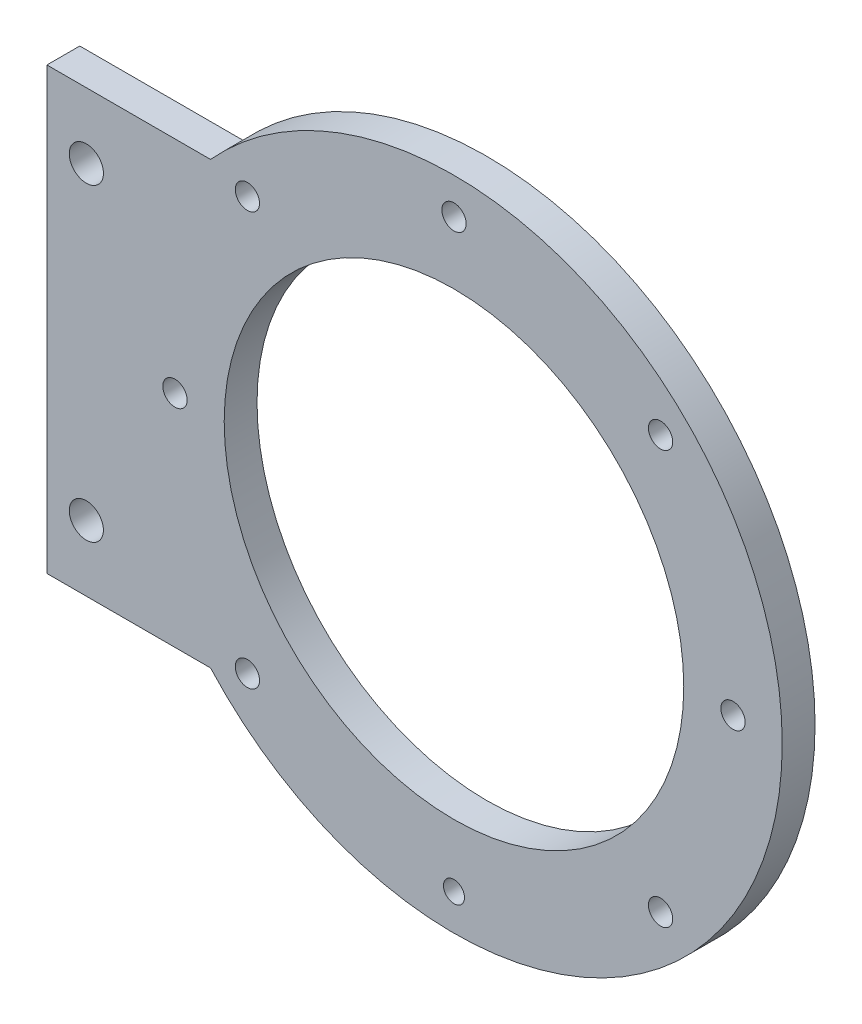
from build123d import *

# Parameters (mm, degrees)
SKETCH_1_R          = 2.6
EXTRUDE_1_DEPTH     = 5
SKETCH_2_R          = 1.85
CUT_EXTRUDE_1_DEPTH = 131.399777478
SKETCH_3_R          = 35
CUT_EXTRUDE_2_DEPTH = 131.399777478
SKETCH_4_R          = 1.85
SKETCH_4_R_2        = 1.6
CUT_EXTRUDE_3_DEPTH = 10


with BuildPart() as part:
    # 草图1 → 凸台-拉伸1 (new body)
    with BuildSketch(Plane.XY):
        with BuildLine():
            Line((-12, -67.082039325), (12.919007565, -67.082039325))
            ThreePointArc((12.919007565, -67.082039325), (100, -33.541019662), (12.919007565, 0))
            Line((12.919007565, 0), (-12, 0))
            Line((-12, 0), (-12, -67.082039325))
        make_face()
        with Locations((-6, -57.082039325)):
            Circle(SKETCH_1_R, mode=Mode.SUBTRACT)
        with Locations((-6, -10)):
            Circle(SKETCH_1_R, mode=Mode.SUBTRACT)
    extrude(amount=EXTRUDE_1_DEPTH)

    # 草图2 → 切除-拉伸1 (cut, through all)
    with BuildSketch(Plane.XY.offset(5)):
        with Locations((92.5, -33.541019662)):
            Circle(SKETCH_2_R)
        with Locations((7.5, -33.541019662)):
            Circle(SKETCH_2_R)
    extrude(amount=-CUT_EXTRUDE_1_DEPTH, mode=Mode.SUBTRACT)

    # 草图3 → 切除-拉伸2 (cut, through all)
    with BuildSketch(Plane.XY.offset(5)):
        with Locations((50, -33.541019662)):
            Circle(SKETCH_3_R)
    extrude(amount=-CUT_EXTRUDE_2_DEPTH, mode=Mode.SUBTRACT)

    # 草图4 → 切除-拉伸3 (cut)
    with BuildSketch(Plane.XY.offset(5)):
        with Locations((50, 10.958980338)):
            Circle(SKETCH_4_R)
        with Locations((81.466251763, -2.0747679)):
            Circle(SKETCH_4_R)
        with Locations((50, -78.041019662)):
            Circle(SKETCH_4_R_2)
        with Locations((81.466251763, -65.007271425)):
            Circle(SKETCH_4_R)
        with Locations((18.533748237, -65.007271425)):
            Circle(SKETCH_4_R)
        with Locations((18.533748237, -2.0747679)):
            Circle(SKETCH_4_R)
    extrude(amount=-CUT_EXTRUDE_3_DEPTH, mode=Mode.SUBTRACT)


solid = part.part
